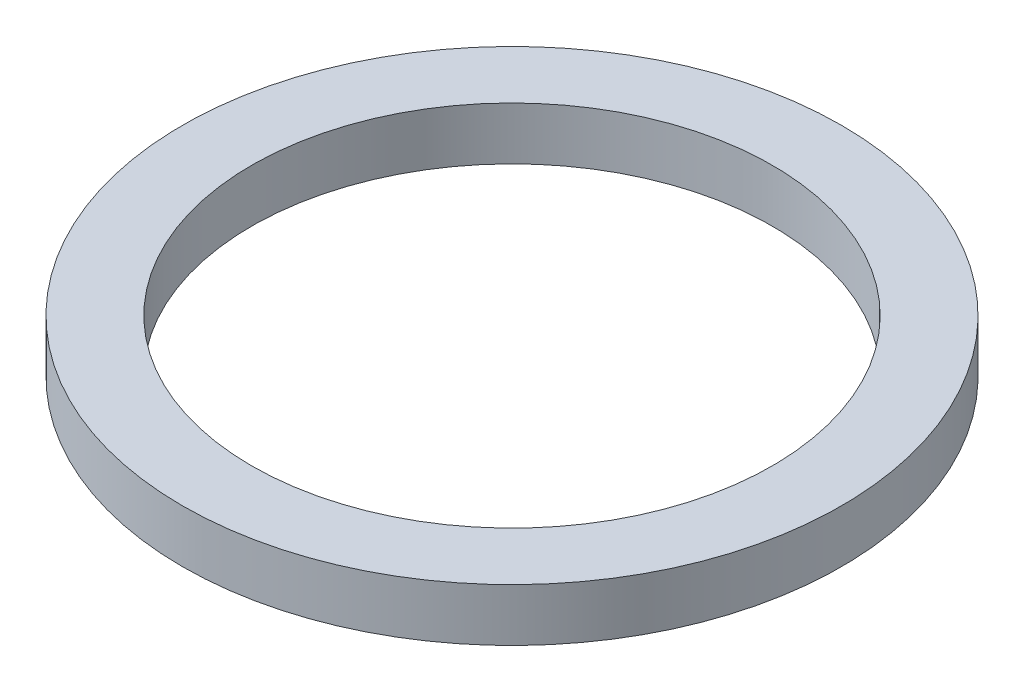
from build123d import *

# Parameters (mm, degrees)
SKETCH1_R           = 3.175
SKETCH1_R_2         = 2.50825
BOSS_EXTRUDE1_DEPTH = 0.508


with BuildPart() as part:
    # Sketch1 → Boss-Extrude1 (new body)
    with BuildSketch(Plane(origin=(0, 0, 0), x_dir=(1, 0, 0), z_dir=(0, 1, 0))):
        with Locations(Location((0, 0, 0), (0, 0, 270))):
            Circle(SKETCH1_R)
        with Locations(Location((0, 0, 0), (0, 0, 270))):
            Circle(SKETCH1_R_2, mode=Mode.SUBTRACT)
    extrude(amount=BOSS_EXTRUDE1_DEPTH)


solid = part.part
